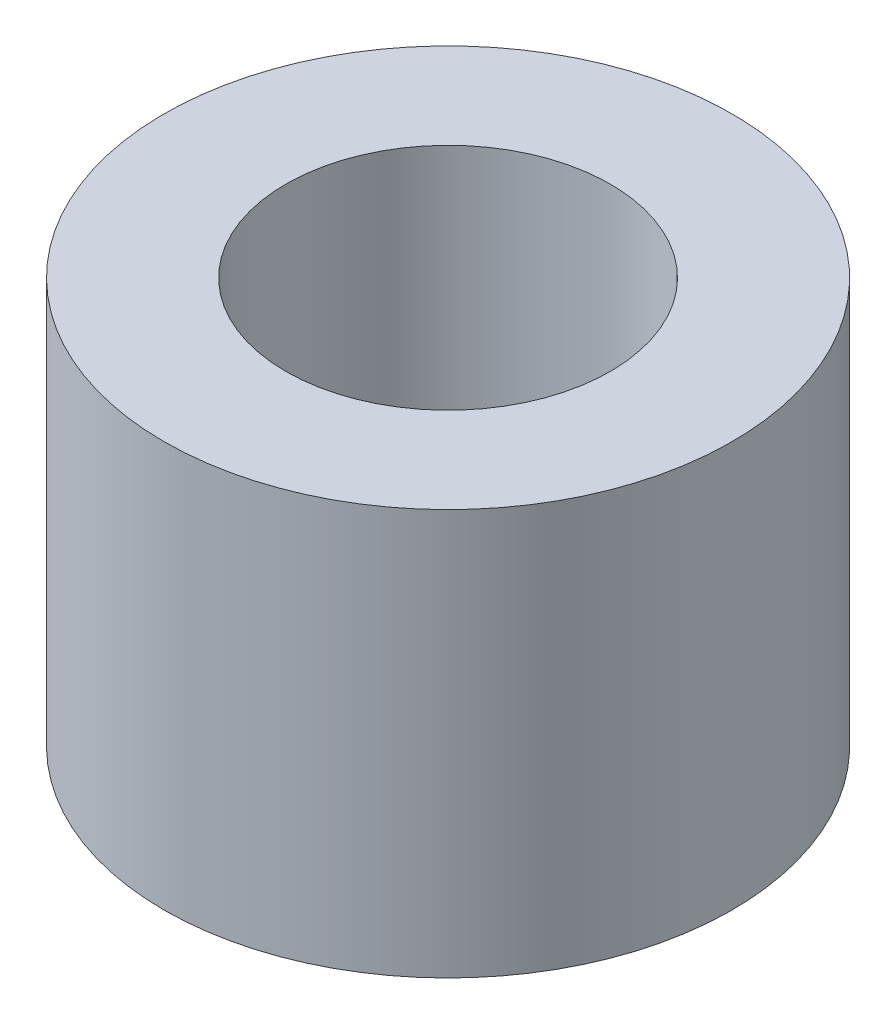
from build123d import *

# Parameters (mm, degrees)
SKETCH_1_R      = 3.5
SKETCH_1_R_2    = 2
EXTRUDE_1_DEPTH = 5


with BuildPart() as part:
    # 草图1 → 凸台-拉伸1 (new body)
    with BuildSketch(Plane(origin=(0, 0, 0), x_dir=(1, 0, 0), z_dir=(0, 1, 0))):
        with Locations(Location((0, 0, 0), (0, 0, 270))):
            Circle(SKETCH_1_R)
        with Locations(Location((0, 0, 0), (0, 0, 270))):
            Circle(SKETCH_1_R_2, mode=Mode.SUBTRACT)
    extrude(amount=EXTRUDE_1_DEPTH)


solid = part.part
